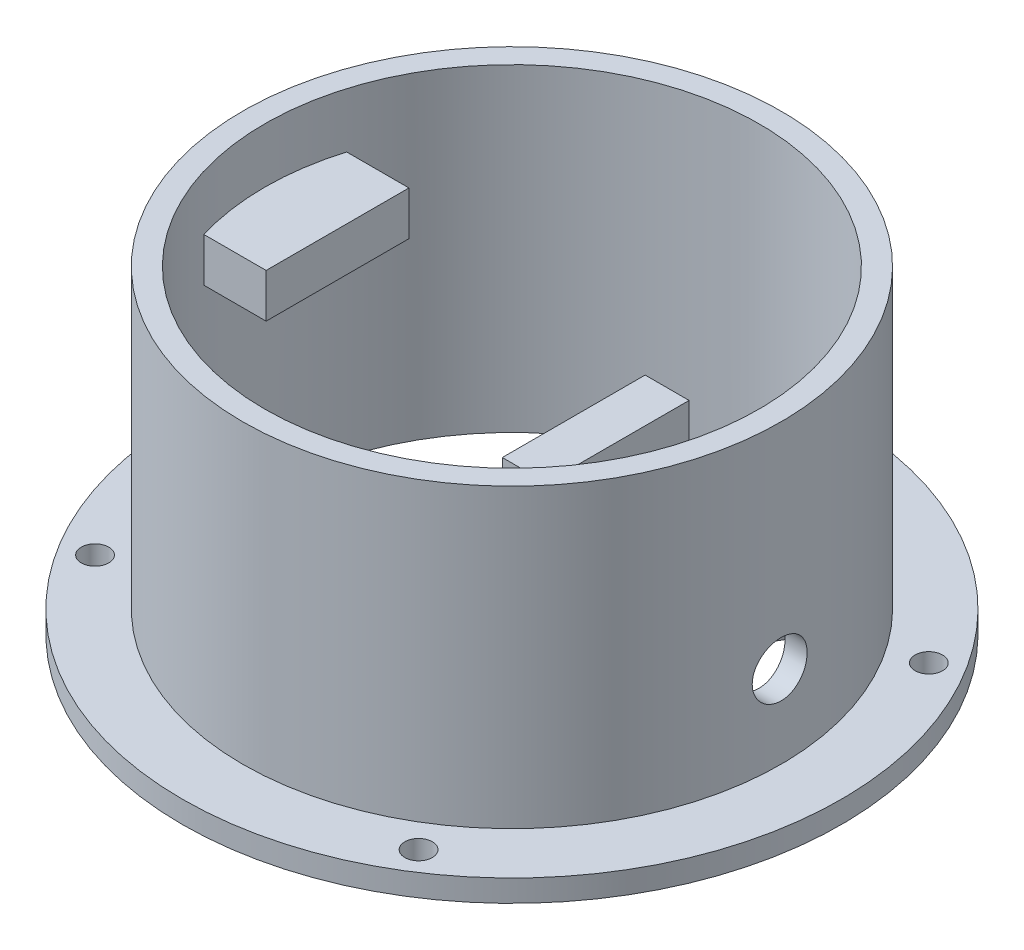
from build123d import *

# Parameters (mm, degrees)
SKETCH1_R            = 60
SKETCH1_R_2          = 45
BOSS_EXTRUDE3_DEPTH  = 4
SKETCH9_R            = 49
SKETCH9_R_2          = 45
BOSS_EXTRUDE5_DEPTH  = 54
SKETCH10_W           = 8
SKETCH10_H           = 40
SKETCH10_W_2         = 15
SKETCH10_H_2         = 8
BOSS_EXTRUDE6_DEPTH  = 13
SKETCH12_W           = 10
SKETCH12_H           = 25
CUT_EXTRUDE1_DEPTH   = 8
SKETCH13_R           = 5
CUT_EXTRUDE2_DEPTH   = 110.729496946
SKETCH14_R           = 1.4
CUT_EXTRUDE3_DEPTH   = 7.2
BOSS_EXTRUDE10_DEPTH = 4
SKETCH18_R           = 2.5
CUT_EXTRUDE4_DEPTH   = 101.578327739


with BuildPart() as part:
    # Sketch1 → Boss-Extrude3 (new body)
    with BuildSketch(Plane(origin=(0, 0, 0), x_dir=(1, 0, 0), z_dir=(0, 1, 0))):
        with Locations(Location((0, 0, 0), (0, 0, 270))):
            Circle(SKETCH1_R)
        with Locations(Location((0, 0, 0), (0, 0, 270))):
            Circle(SKETCH1_R_2, mode=Mode.SUBTRACT)
    extrude(amount=BOSS_EXTRUDE3_DEPTH)

    # Sketch9 → Boss-Extrude5 (add)
    with BuildSketch(Plane(origin=(0, 4, 0), x_dir=(1, 0, 0), z_dir=(0, 1, 0))):
        with Locations(Location((0, 0, 0), (0, 0, 270))):
            Circle(SKETCH9_R)
        with Locations(Location((0, 0, 0), (0, 0, 270))):
            Circle(SKETCH9_R_2, mode=Mode.SUBTRACT)
    extrude(amount=BOSS_EXTRUDE5_DEPTH)

    # Sketch10 → Boss-Extrude6 (add, symmetric)
    with BuildSketch(Plane.XY):
        with Locations((15.25, 20)):
            Rectangle(SKETCH10_W, SKETCH10_H)
        with Locations((-39.25, 44)):
            Rectangle(SKETCH10_W_2, SKETCH10_H_2)
    extrude(amount=BOSS_EXTRUDE6_DEPTH, both=True)


with BuildPart() as boss_extrude6_piece_1:
    # of the separate pieces the step leaves, piece 1, a body of its own (boss_extrude6_pieces)
    add(part.part.solids().sort_by_distance((0, 0, 60))[0])

    # Sketch13 → Cut-Extrude2 (cut, through all)
    with BuildSketch(Plane.ZY.offset(-11.25)):
        with Locations((0, 19)):
            Circle(SKETCH13_R)
    extrude(amount=-CUT_EXTRUDE2_DEPTH, mode=Mode.SUBTRACT)



with BuildPart() as boss_extrude6_piece_2:
    # of the separate pieces the step leaves, piece 2, a body of its own (boss_extrude6_pieces)
    add(part.part.solids().sort_by_distance((11.25, 0, -13))[0])

    # Sketch12 → Cut-Extrude1 (cut)
    with BuildSketch(Plane.ZY.offset(-11.25)):
        with Locations((0, 17.5)):
            Rectangle(SKETCH12_W, SKETCH12_H)
    extrude(amount=-CUT_EXTRUDE1_DEPTH, mode=Mode.SUBTRACT)

    # Sketch14 → Cut-Extrude3 (cut)
    with BuildSketch(Plane.XZ):
        with Locations((-34, -7.797761416)):
            Circle(SKETCH14_R)
        with Locations(Location((14, -7.797761416, 0), (0, 0, 270))):
            Circle(SKETCH14_R)
        with Locations(Location((14, 7.797761416, 0), (0, 0, 90))):
            Circle(SKETCH14_R)
        with Locations((-34, 7.797761416)):
            Circle(SKETCH14_R)
    extrude(amount=-CUT_EXTRUDE3_DEPTH, mode=Mode.SUBTRACT)


with BuildPart() as boss_extrude6_piece_1_1:
    add(boss_extrude6_piece_1.part)

    add(boss_extrude6_piece_2.part)  # Boss-Extrude10 merges Boss-Extrude6 piece 2
    # Sketch15 → Boss-Extrude10 (add)
    with BuildSketch(Plane.XZ):
        with BuildLine():
            Line((25.249838503, 37.248431585), (11.25, 13))
            Line((11.25, 13), (11.25, -13))
            Line((11.25, -13), (25.249838503, -37.248431585))
            ThreePointArc((25.249838503, -37.248431585), (39.757029144, -21.080290171), (45, 0))
            ThreePointArc((45, 0), (39.757029144, 21.080290171), (25.249838503, 37.248431585))
        make_face()
        with BuildLine():
            Line((24.25, -21.516660498), (24.25, 21.516660498))
            Line((24.25, 21.516660498), (27.167270196, 26.569520697))
            ThreePointArc((27.167270196, 26.569520697), (38, 0), (27.167270196, -26.569520697))
            Line((27.167270196, -26.569520697), (24.25, -21.516660498))
        make_face(mode=Mode.SUBTRACT)
    extrude(amount=-BOSS_EXTRUDE10_DEPTH)

    # Sketch18 → Cut-Extrude4 (cut, through all)
    with BuildSketch(Plane(origin=(0, 4, 0), x_dir=(1, 0, 0), z_dir=(0, 1, 0))):
        with Locations(Location((46.451404387, 29.449397795, 0), (0, 0, 270))):
            Circle(SKETCH18_R)
        with Locations(Location((29.449397795, -46.451404387, 0), (0, 0, 270))):
            Circle(SKETCH18_R)
        with Locations(Location((-46.451404387, -29.449397795, 0), (0, 0, 270))):
            Circle(SKETCH18_R)
        with Locations(Location((-29.449397795, 46.451404387, 0), (0, 0, 270))):
            Circle(SKETCH18_R)
    extrude(amount=-CUT_EXTRUDE4_DEPTH, mode=Mode.SUBTRACT)


solid = boss_extrude6_piece_1_1.part
